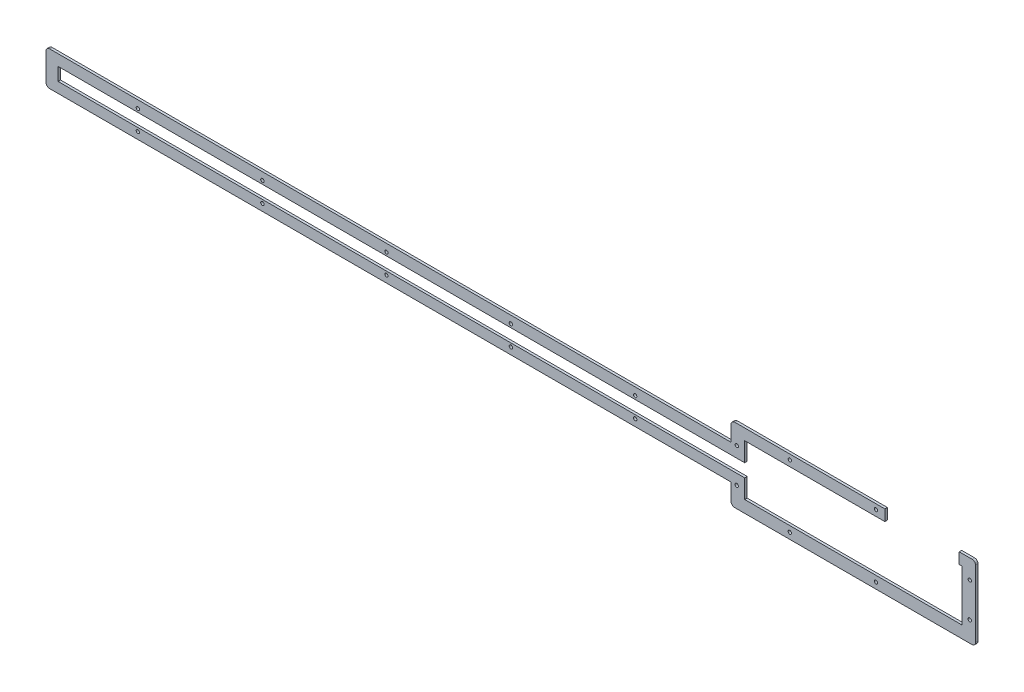
from build123d import *

# Parameters (mm, degrees)
SKETCH1_R           = 1.720095417
SKETCH1_R_2         = 1.632335783
BOSS_EXTRUDE1_DEPTH = 2.54


with BuildPart() as part:
    # Sketch1 → Boss-Extrude1 (new body)
    with BuildSketch(Plane.XY):
        with BuildLine():
            Line((0.359622665, 112.547896558), (0.359622665, 84.647626996))
            ThreePointArc((0.359622665, 84.647626996), (1.569547298, 82.016705042), (4.285435965, 81.011908201))
            Line((4.285435965, 81.011908201), (699.960441306, 81.011908201))
            Line((699.960441306, 81.011908201), (699.960441306, 64.012598058))
            ThreePointArc((699.960441306, 64.012598058), (701.213068629, 61.288906282), (704.024750828, 60.24870663))
            Line((704.024750828, 60.24870663), (946.192785632, 60.24870663))
            ThreePointArc((946.192785632, 60.24870663), (948.74540471, 61.39621374), (949.738968911, 64.012598058))
            Line((949.738968911, 64.012598058), (949.738968911, 132.475411377))
            ThreePointArc((949.738968911, 132.475411377), (948.657072186, 134.878542119), (946.192785632, 135.812795653))
            Line((946.192785632, 135.812795653), (933.071984653, 135.812795653))
            Line((933.071984653, 135.812795653), (933.071984653, 124.543323228))
            Line((933.071984653, 124.543323228), (935.984655082, 124.543323228))
            Line((935.984655082, 124.543323228), (935.984655082, 72.51225313))
            Line((935.984655082, 72.51225313), (714.00720644, 72.51225313))
            Line((714.00720644, 72.51225313), (714.00720644, 91.663924817))
            Line((714.00720644, 91.663924817), (12.71320644, 91.663924817))
            Line((12.71320644, 91.663924817), (12.71320644, 104.995667719))
            Line((12.71320644, 104.995667719), (714.00720644, 104.995667719))
            Line((714.00720644, 104.995667719), (714.00720644, 124.543323228))
            Line((714.00720644, 124.543323228), (857.125984653, 124.543323228))
            Line((857.125984653, 124.543323228), (857.125984653, 135.812795653))
            Line((857.125984653, 135.812795653), (704.024750828, 135.812795653))
            ThreePointArc((704.024750828, 135.812795653), (701.183091811, 134.700225562), (699.960441306, 131.904163347))
            Line((699.960441306, 131.904163347), (699.960441306, 116.18243367))
            Line((699.960441306, 116.18243367), (4.285435965, 116.18243367))
            ThreePointArc((4.285435965, 116.18243367), (1.569792033, 115.17822767), (0.359622665, 112.547896558))
        make_face()
        with Locations((94.1622142, 88.091107164)):
            Circle(SKETCH1_R, mode=Mode.SUBTRACT)
        with Locations((221.392126764, 88.091107164)):
            Circle(SKETCH1_R, mode=Mode.SUBTRACT)
        with Locations((348.078760153, 88.091107164)):
            Circle(SKETCH1_R_2, mode=Mode.SUBTRACT)
        with Locations((760.070975046, 66.505299661)):
            Circle(SKETCH1_R, mode=Mode.SUBTRACT)
        with Locations((848.138968911, 66.505299661)):
            Circle(SKETCH1_R, mode=Mode.SUBTRACT)
        with Locations((475.146430575, 88.091107164)):
            Circle(SKETCH1_R, mode=Mode.SUBTRACT)
        with Locations((705.892847696, 81.011908201)):
            Circle(SKETCH1_R, mode=Mode.SUBTRACT)
        with Locations((602.130384222, 88.091107164)):
            Circle(SKETCH1_R, mode=Mode.SUBTRACT)
        with Locations((943.890172073, 81.011908201)):
            Circle(SKETCH1_R, mode=Mode.SUBTRACT)
        with Locations((94.1622142, 108.484732819)):
            Circle(SKETCH1_R, mode=Mode.SUBTRACT)
        with Locations((221.392126764, 108.484732819)):
            Circle(SKETCH1_R, mode=Mode.SUBTRACT)
        with Locations((348.078760153, 108.484732819)):
            Circle(SKETCH1_R, mode=Mode.SUBTRACT)
        with Locations((475.146430575, 108.484732819)):
            Circle(SKETCH1_R, mode=Mode.SUBTRACT)
        with Locations((602.130384222, 108.484732819)):
            Circle(SKETCH1_R, mode=Mode.SUBTRACT)
        with Locations((705.892847696, 116.18243367)):
            Circle(SKETCH1_R, mode=Mode.SUBTRACT)
        with Locations((943.890172073, 116.18243367)):
            Circle(SKETCH1_R, mode=Mode.SUBTRACT)
        with Locations((760.070975046, 130.611938178)):
            Circle(SKETCH1_R, mode=Mode.SUBTRACT)
        with Locations((848.138968911, 130.611938178)):
            Circle(SKETCH1_R, mode=Mode.SUBTRACT)
    extrude(amount=BOSS_EXTRUDE1_DEPTH)


solid = part.part
